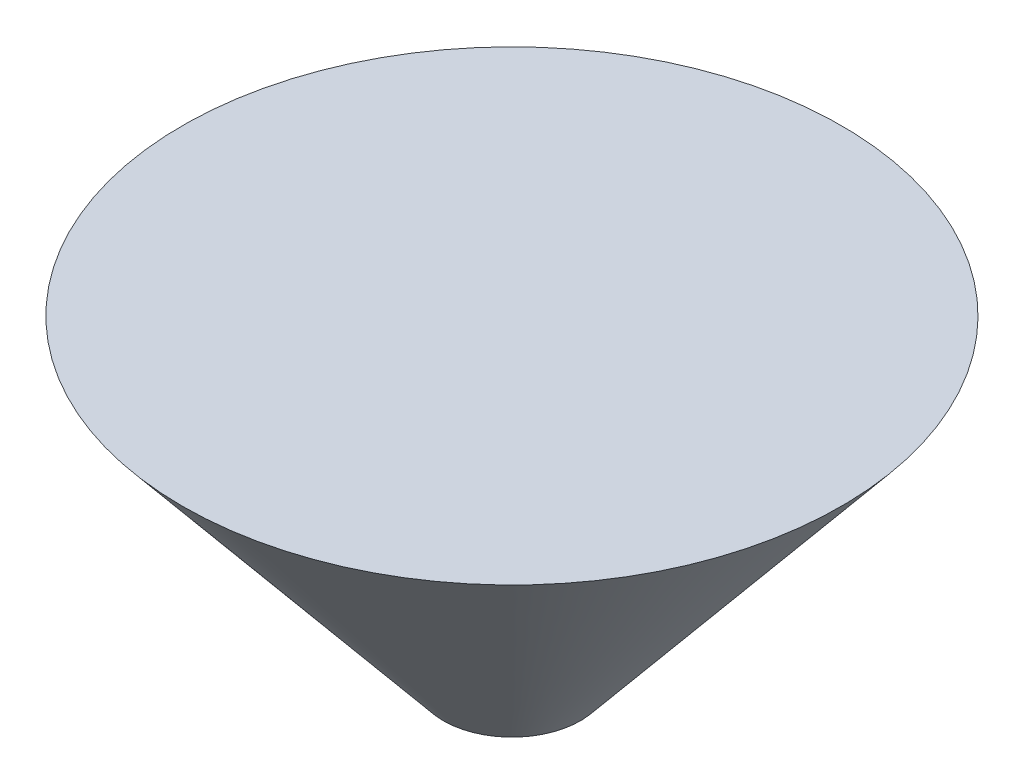
from build123d import *


with BuildPart() as part:
    # Sketch1 → Cono_de_union (revolve)
    with BuildSketch(Plane.XY, mode=Mode.PRIVATE) as cono_de_union_sk:
        Polygon((0, 0), (12.5, 0), (2.6, -12), (0, -12), align=None)
    revolve(cono_de_union_sk.sketch.rotate(Axis((0, -16, 0), (0, 1, 0)), 270), axis=Axis((0, -16, 0), (0, 1, 0)))


solid = part.part
